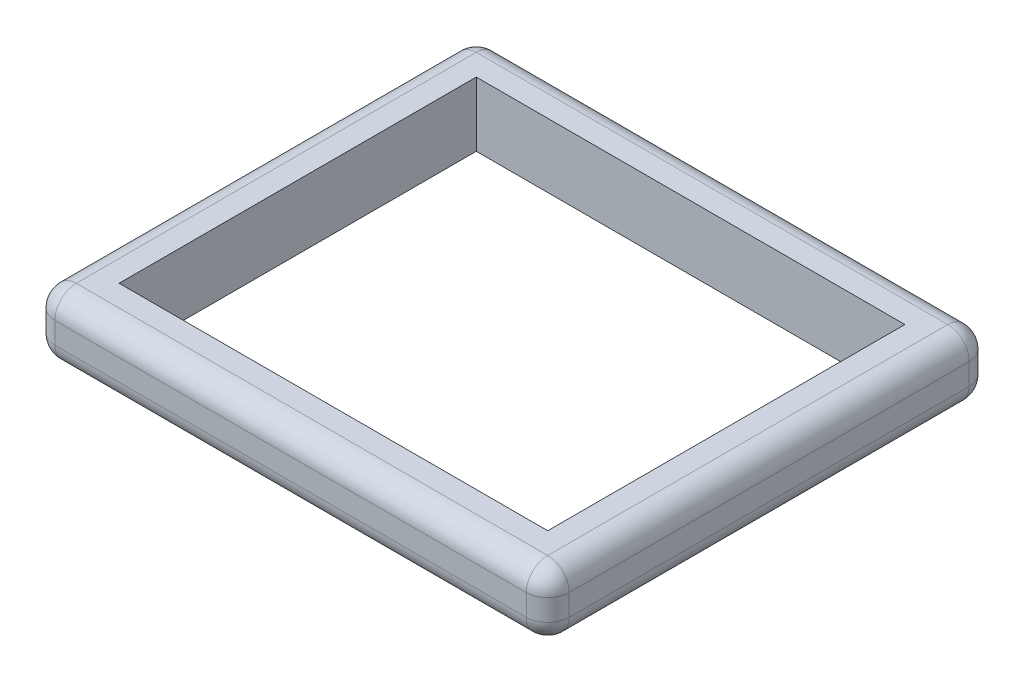
from build123d import *

# Parameters (mm, degrees)
SKETCH1_W           = 914.4
SKETCH1_H           = 787.4
SKETCH1_W_2         = 762
SKETCH1_H_2         = 635
BOSS_EXTRUDE1_DEPTH = 114.3
FILLET2_R           = 38.1
FILLET3_R           = 38.1
FILLET4_R           = 38.1


with BuildPart() as part:
    # Sketch1 → Boss-Extrude1 (new body)
    with BuildSketch(Plane(origin=(0, 0, 0), x_dir=(1, 0, 0), z_dir=(0, 1, 0))):
        Rectangle(SKETCH1_W, SKETCH1_H)
        Rectangle(SKETCH1_W_2, SKETCH1_H_2, mode=Mode.SUBTRACT)
    extrude(amount=BOSS_EXTRUDE1_DEPTH)

    # Fillet2
    fillet2_edges = [part.edges().sort_by_distance(p)[0] for p in [
        (457.2, 57.15, 393.7),
        (-457.2, 57.15, 393.7),
        (-457.2, 57.15, -393.7),
        (457.2, 57.15, -393.7),
    ]]
    fillet(fillet2_edges, radius=FILLET2_R)

    # Fillet3
    fillet3_edges = [part.edges().sort_by_distance(p)[0] for p in [
        (457.2, 114.3, 0),
        (0, 114.3, 393.7),
        (0, 114.3, -393.7),
        (-457.2, 114.3, 0),
        (446.040768363, 114.3, -382.540768363),
        (-446.040768363, 114.3, -382.540768363),
        (-446.040768363, 114.3, 382.540768363),
        (446.040768363, 114.3, 382.540768363),
    ]]
    fillet(fillet3_edges, radius=FILLET3_R)

    # Fillet4
    fillet4_edges = [part.edges().sort_by_distance(p)[0] for p in [
        (457.2, 0, 0),
        (0, 0, 393.7),
        (-457.2, 0, 0),
        (0, 0, -393.7),
        (446.040768363, 0, -382.540768363),
        (-446.040768363, 0, -382.540768363),
        (-446.040768363, 0, 382.540768363),
        (446.040768363, 0, 382.540768363),
    ]]
    fillet(fillet4_edges, radius=FILLET4_R)


solid = part.part
